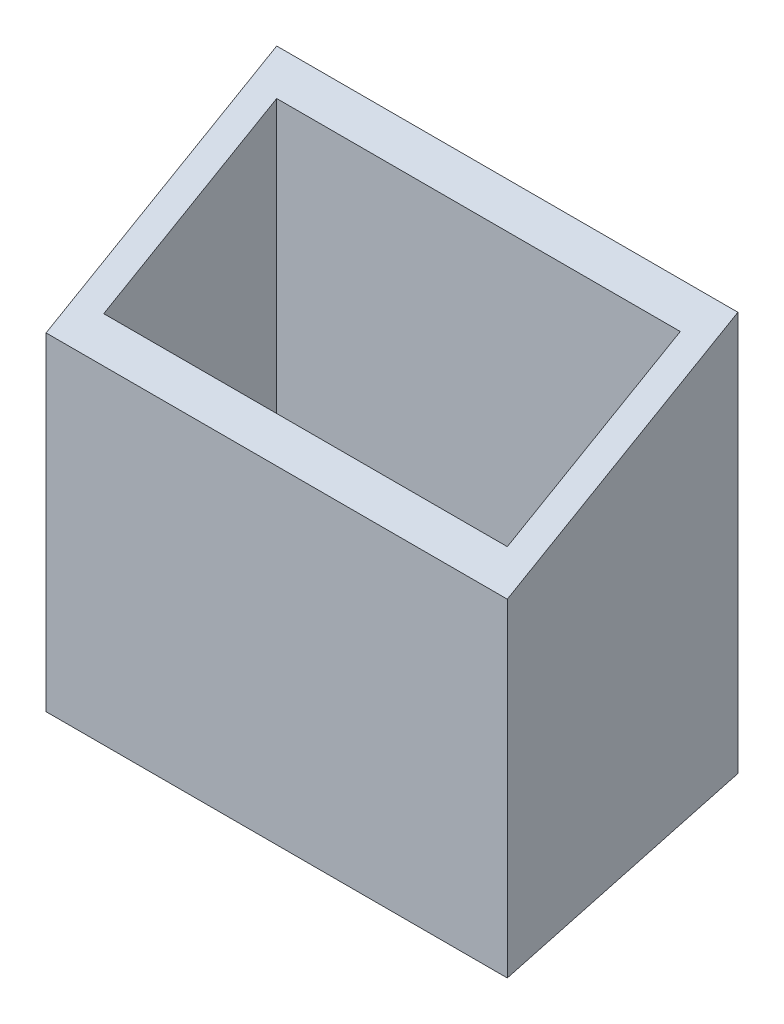
from build123d import *

# Parameters (mm, degrees)
SKETCH1_W           = 50.8
SKETCH1_H           = 25.4
SKETCH1_W_2         = 44.45
SKETCH1_H_2         = 19.05
BOSS_EXTRUDE1_DEPTH = 50.8
CUT_EXTRUDE1_DEPTH  = 73.955945611
CUT_EXTRUDE2_DEPTH  = 73.955945611


with BuildPart() as part:
    # Sketch1 → Boss-Extrude1 (new body)
    with BuildSketch(Plane(origin=(0, 0, 0), x_dir=(1, 0, 0), z_dir=(0, 1, 0))):
        Rectangle(SKETCH1_W, SKETCH1_H)
        Rectangle(SKETCH1_W_2, SKETCH1_H_2, mode=Mode.SUBTRACT)
    extrude(amount=BOSS_EXTRUDE1_DEPTH)

    # Sketch2 → Cut-Extrude1 (cut, through all)
    with BuildSketch(Plane.ZY.offset(25.4)):
        Polygon((12.7, 50.8), (-12.7, 50.8), (12.7, 36.135303163), align=None)
    extrude(amount=-CUT_EXTRUDE1_DEPTH, mode=Mode.SUBTRACT)

    # Sketch3 → Cut-Extrude2 (cut, through all)
    with BuildSketch(Plane(origin=(25.4, 0, 0), x_dir=(0, 0, -1), z_dir=(1, 0, 0))):
        Polygon((12.7, 6.805909488), (-12.7, 0), (12.7, 0), align=None)
    extrude(amount=-CUT_EXTRUDE2_DEPTH, mode=Mode.SUBTRACT)


solid = part.part
